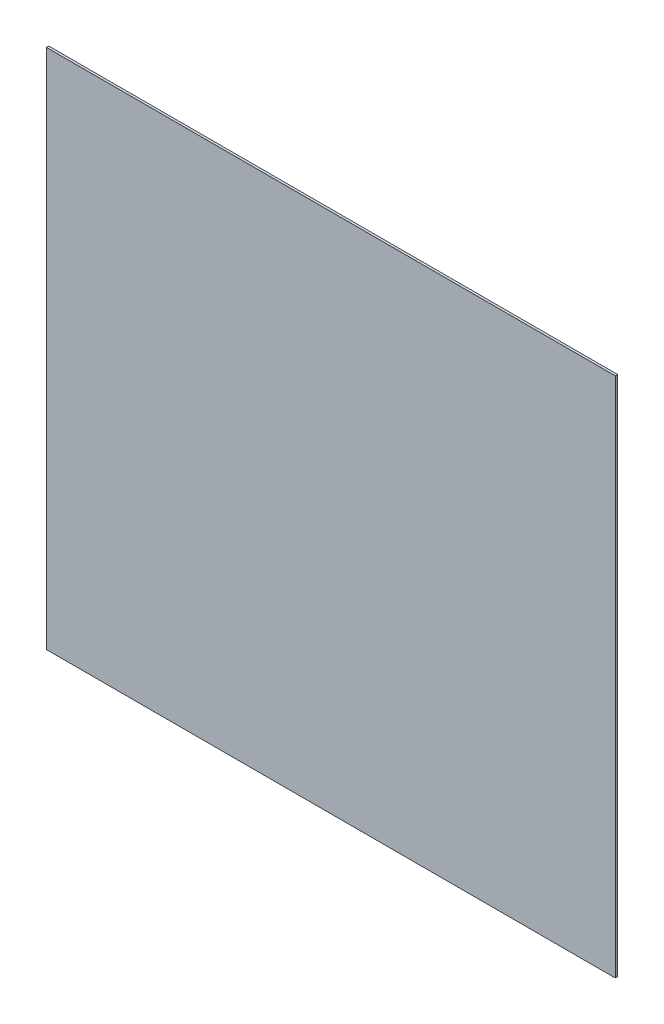
from build123d import *

# Parameters (mm, degrees)
SKETCH_1_W      = 48
SKETCH_1_H      = 44
EXTRUDE_1_DEPTH = 0.2


with BuildPart() as part:
    # 스케치1 → 보스-돌출1 (new body)
    with BuildSketch(Plane.XY):
        with Locations((24, 22)):
            Rectangle(SKETCH_1_W, SKETCH_1_H)
    extrude(amount=EXTRUDE_1_DEPTH)


solid = part.part
